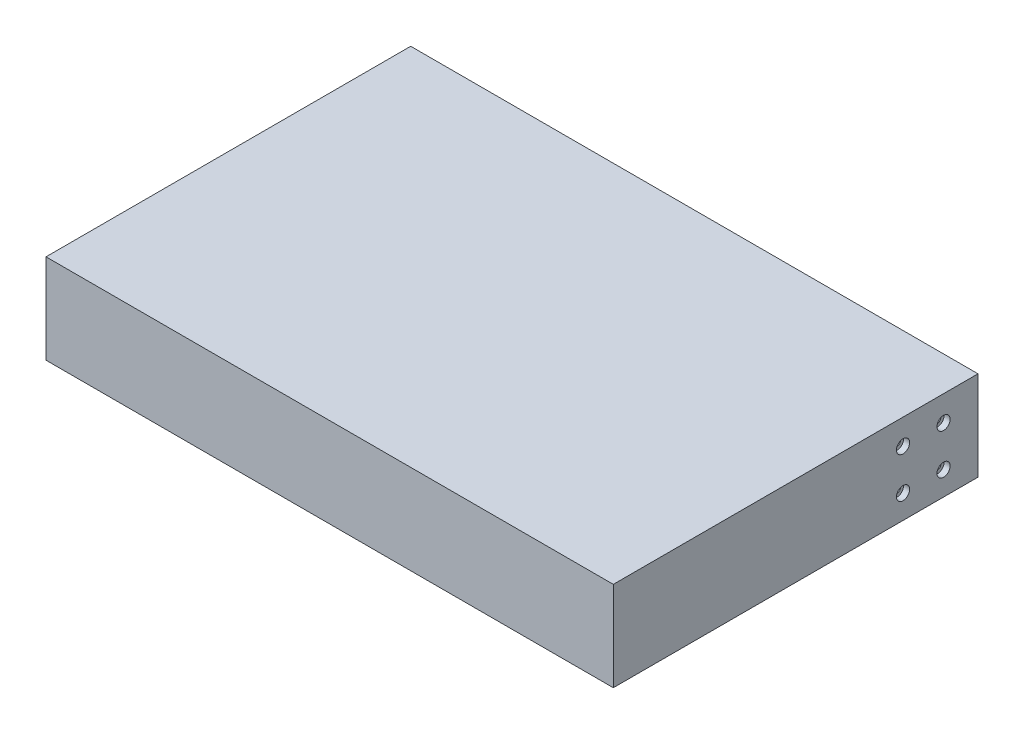
from build123d import *

# Parameters (mm, degrees)
SKETCH1_W                     = 280
SKETCH1_H                     = 44.2
BOSS_EXTRUDE1_DEPTH           = 180
SKETCH2_W                     = 4.274038461
SKETCH2_H                     = 1.139743589
CUT_EXTRUDE1_DEPTH            = 10
CBORE_FOR_M3_SHCS1_AT_2_COUNT = 2
CBORE_FOR_M3_SHCS1_AT_2_PITCH = 20
CBORE_FOR_M3_SHCS1_AT_3_COUNT = 2
CBORE_FOR_M3_SHCS1_AT_3_PITCH = 20
CBORE_FOR_M3_SHCS1_AT_4_COUNT = 2
CBORE_FOR_M3_SHCS1_AT_4_PITCH = 28.284271247


with BuildPart() as part:
    # Sketch1 → Boss-Extrude1 (new body)
    with BuildSketch(Plane.XY):
        Rectangle(SKETCH1_W, SKETCH1_H)
    extrude(amount=BOSS_EXTRUDE1_DEPTH)

    # Sketch2 → Cut-Extrude1 (cut)
    # profile 1 of 17: a face of its own
    with BuildSketch(Plane(origin=(0, 0, 0), x_dir=(-1, 0, 0), z_dir=(0, 0, -1))):
        Polygon((-78.844547364, 1.549676889), (-78.844547364, 2.689420479), (-73.003361466, 2.689420479), (-73.003361466, 1.549676889), (-75.425316595, 1.549676889), (-75.425316595, -8.423079521), (-76.422592236, -8.423079521), (-76.422592236, 1.549676889), align=None)
    # profile 2 of 17: a face of its own
    with BuildSketch(Plane(origin=(0, 0, 0), x_dir=(-1, 0, 0), z_dir=(0, 0, -1))):
        with BuildLine():
            Line((-71.293746082, 2.689420479), (-69.069910445, 2.689420479))
            add(Edge.make_bspline(
                [(-69.069910445, 2.689420479), (-68.921507362, 2.688926493), (-68.636557003, 2.687977987), (-68.22833687, 2.682689189), (-67.857410837, 2.66753061), (-67.523972847, 2.654485857), (-67.228029017, 2.630698944), (-66.968671869, 2.607963889), (-66.74709593, 2.578202516), (-66.612965352, 2.550562798), (-66.552234663, 2.538048283)],
                knots=[0, 0, 0, 0, 1.410062039, 2.707475311, 3.878576406, 4.937260626, 5.877586885, 6.699081471, 7.410979367, 8, 8, 8, 8], degree=3))
            add(Edge.make_bspline(
                [(-66.552234663, 2.538048283), (-66.470933632, 2.517960803), (-66.31006594, 2.478214364), (-66.078449481, 2.394205131), (-65.857741502, 2.296987823), (-65.64885881, 2.182803011), (-65.452847673, 2.050803086), (-65.267687036, 1.903266797), (-65.09253669, 1.741001418), (-64.934480014, 1.559915797), (-64.785448525, 1.369934878), (-64.659754636, 1.164500451), (-64.551403063, 0.949675101), (-64.465136671, 0.723274049), (-64.395674105, 0.487492924), (-64.346695795, 0.240195994), (-64.317323275, -0.017490102), (-64.314332883, -0.193251462), (-64.312816595, -0.282371889)],
                knots=[0, 0, 0, 0, 1.027469482, 2.033020251, 3.019912614, 3.986113645, 4.951240523, 5.91722682, 6.890402269, 7.87763091, 8.8651537, 9.85103654, 10.82876324, 11.815024772, 12.821070561, 13.842952187, 14.906261191, 16, 16, 16, 16], degree=3))
            add(Edge.make_bspline(
                [(-64.312816595, -0.282371889), (-64.317480664, -0.430438346), (-64.32658147, -0.719354354), (-64.411433674, -1.138647652), (-64.550424124, -1.529773726), (-64.741950567, -1.892240102), (-64.985852402, -2.218981401), (-65.278983614, -2.505971096), (-65.621507731, -2.746127819), (-65.940370809, -2.912665474), (-66.222038393, -3.019322959), (-66.453919161, -3.094368398), (-66.706861814, -3.152350138), (-66.978442852, -3.204293556), (-67.269792458, -3.243510186), (-67.580212333, -3.272233123), (-67.909923865, -3.290184728), (-68.13642541, -3.292858094), (-68.252945801, -3.294233367)],
                knots=[0, 0, 0, 0, 1.260483769, 2.459530307, 3.627416485, 4.787058657, 5.939039949, 7.08810263, 8.267026773, 9.491475466, 10.141966685, 10.831826277, 11.566392101, 12.351337768, 13.187381173, 14.07005841, 15.007169909, 16, 16, 16, 16], degree=3))
            Line((-68.252945801, -3.294233367), (-64.170348646, -8.423079521))
            Line((-64.170348646, -8.423079521), (-65.403586827, -8.423079521))
            Line((-65.403586827, -8.423079521), (-69.486183982, -3.294233367))
            Line((-69.486183982, -3.294233367), (-70.296470441, -3.294233367))
            Line((-70.296470441, -3.294233367), (-70.296470441, -8.423079521))
            Line((-70.296470441, -8.423079521), (-71.293746082, -8.423079521))
            Line((-71.293746082, -8.423079521), (-71.293746082, 2.689420479))
        make_face()
        with BuildLine():
            Line((-70.296470441, 1.549676889), (-70.296470441, -2.154489777))
            Line((-70.296470441, -2.154489777), (-68.261850048, -2.170072209))
            add(Edge.make_bspline(
                [(-68.261850048, -2.170072209), (-68.166853924, -2.170114236), (-67.982724381, -2.170195695), (-67.71633977, -2.157515455), (-67.468308415, -2.14309042), (-67.239579027, -2.121026248), (-67.030049425, -2.09259072), (-66.839824338, -2.057021245), (-66.668593249, -2.015580946), (-66.468890389, -1.951440784), (-66.245889402, -1.849821676), (-66.003537017, -1.701976218), (-65.797154595, -1.516019264), (-65.622790382, -1.303378542), (-65.482679437, -1.069583452), (-65.383898664, -0.817436479), (-65.32121641, -0.553303156), (-65.313823278, -0.371762663), (-65.310092236, -0.280145827)],
                knots=[0, 0, 0, 0, 1.146690395, 2.22261258, 3.21895312, 4.145990853, 4.996080663, 5.770904154, 6.481378293, 7.121626537, 8.300444488, 9.431385265, 10.535395872, 11.636531494, 12.74115979, 13.810798291, 14.895190096, 16, 16, 16, 16], degree=3))
            add(Edge.make_bspline(
                [(-65.310092236, -0.280145827), (-65.31390897, -0.190780456), (-65.321472345, -0.013690898), (-65.383222185, 0.245566617), (-65.487645971, 0.490254184), (-65.628369076, 0.719376424), (-65.799816393, 0.927357135), (-66.000850449, 1.105306846), (-66.225974443, 1.252148897), (-66.436385498, 1.345984055), (-66.624454123, 1.403514589), (-66.787743293, 1.443999534), (-66.972247235, 1.476525723), (-67.178861816, 1.502586316), (-67.406704994, 1.524985764), (-67.656928811, 1.540072661), (-67.927873088, 1.54900668), (-68.115664595, 1.549448287), (-68.212876691, 1.549676889)],
                knots=[0, 0, 0, 0, 1.101028733, 2.181837193, 3.264309656, 4.369019818, 5.486613113, 6.575447106, 7.666700264, 8.788928104, 9.402425223, 10.0903467, 10.862060571, 11.710948788, 12.657782767, 13.684531032, 14.801375019, 16, 16, 16, 16], degree=3))
            Line((-68.212876691, 1.549676889), (-70.296470441, 1.549676889))
        make_face(mode=Mode.SUBTRACT)
    # profile 3 of 17: a face of its own
    with BuildSketch(Plane(origin=(0, 0, 0), x_dir=(-1, 0, 0), z_dir=(0, 0, -1))):
        Polygon((-61.890861466, 2.689420479), (-55.622271723, 2.689420479), (-55.622271723, 1.549676889), (-60.893585825, 1.549676889), (-60.893585825, -1.86955388), (-55.622271723, -1.86955388), (-55.622271723, -3.00929747), (-60.893585825, -3.00929747), (-60.893585825, -7.283335931), (-55.622271723, -7.283335931), (-55.622271723, -8.423079521), (-61.890861466, -8.423079521), align=None)
    # profile 4 of 17: a face of its own
    with BuildSketch(Plane(origin=(0, 0, 0), x_dir=(-1, 0, 0), z_dir=(0, 0, -1))):
        Polygon((-53.627720441, -8.423079521), (-53.627720441, 2.689420479), (-53.418470641, 2.689420479), (-46.076919159, -6.056775935), (-46.076919159, 2.689420479), (-45.079643518, 2.689420479), (-45.079643518, -8.423079521), (-45.306701811, -8.423079521), (-52.6304448, 0.303082338), (-52.6304448, -8.423079521), align=None)
    # profile 5 of 17: a face of its own
    with BuildSketch(Plane(origin=(0, 0, 0), x_dir=(-1, 0, 0), z_dir=(0, 0, -1))):
        with BuildLine():
            Line((-42.230284543, -8.423079521), (-42.230284543, 2.689420479))
            Line((-42.230284543, 2.689420479), (-39.986414351, 2.689420479))
            add(Edge.make_bspline(
                [(-39.986414351, 2.689420479), (-39.791250313, 2.688015319), (-39.414194409, 2.685300558), (-38.869324888, 2.668087641), (-38.365186442, 2.637637912), (-37.903437114, 2.593284667), (-37.482809266, 2.538823785), (-37.104480686, 2.470560001), (-36.766495132, 2.38995256), (-36.558629658, 2.321228255), (-36.46033262, 2.288729373)],
                knots=[0, 0, 0, 0, 1.314313732, 2.53924729, 3.670748893, 4.714932338, 5.66265055, 6.526160246, 7.303039223, 8, 8, 8, 8], degree=3))
            add(Edge.make_bspline(
                [(-36.46033262, 2.288729373), (-36.331761823, 2.239736883), (-36.077535787, 2.142862889), (-35.715563173, 1.960121632), (-35.374805146, 1.753070034), (-35.053434361, 1.52143517), (-34.758791737, 1.258658364), (-34.479366665, 0.975902117), (-34.226589917, 0.662884137), (-33.995106077, 0.32609605), (-33.786395358, -0.030494716), (-33.604978532, -0.406208686), (-33.454312103, -0.799137822), (-33.329238609, -1.208189416), (-33.230666106, -1.634262916), (-33.163413473, -2.077854441), (-33.11905558, -2.537210867), (-33.114597717, -2.848914789), (-33.112335825, -3.007071408)],
                knots=[0, 0, 0, 0, 0.984719456, 1.947108742, 2.898477687, 3.838006223, 4.779231079, 5.722358779, 6.681677486, 7.655904652, 8.64651281, 9.637519902, 10.640069247, 11.656948941, 12.698408672, 13.768548281, 14.867775369, 16, 16, 16, 16], degree=3))
            add(Edge.make_bspline(
                [(-33.112335825, -3.007071408), (-33.114332797, -3.14442584), (-33.118268038, -3.415097095), (-33.153603616, -3.814006939), (-33.204963432, -4.201082528), (-33.284478761, -4.574480625), (-33.381006741, -4.937472717), (-33.504717921, -5.286190093), (-33.646435621, -5.623831688), (-33.811693986, -5.945832174), (-33.993117883, -6.250896881), (-34.187814418, -6.538474183), (-34.395575926, -6.804460512), (-34.61838356, -7.049661355), (-34.85335806, -7.273707066), (-35.10203781, -7.478469215), (-35.365064496, -7.659941277), (-35.641260041, -7.825254345), (-35.938681751, -7.969463974), (-36.262963126, -8.091479255), (-36.615487116, -8.192592259), (-36.995388429, -8.276954853), (-37.403323471, -8.343875289), (-37.839692188, -8.388726585), (-38.303824132, -8.419057146), (-38.622528299, -8.421712695), (-38.786567095, -8.423079521)],
                knots=[0, 0, 0, 0, 1.105936401, 2.179363191, 3.223086493, 4.248585256, 5.251745608, 6.245858792, 7.225916811, 8.198733463, 9.158002045, 10.082870192, 10.993790845, 11.873723703, 12.748670949, 13.606408763, 14.465103618, 15.319838547, 16.196477973, 17.123216899, 18.106603292, 19.147568657, 20.255746949, 21.433717677, 22.679120308, 24, 24, 24, 24], degree=3))
            Line((-38.786567095, -8.423079521), (-42.230284543, -8.423079521))
        make_face()
        with BuildLine():
            Line((-41.233008902, -7.283335931), (-39.957475549, -7.283335931))
            add(Edge.make_bspline(
                [(-39.957475549, -7.283335931), (-39.774187972, -7.282548225), (-39.421658837, -7.281033178), (-38.914744695, -7.267738808), (-38.451577612, -7.246015657), (-38.032091819, -7.215614785), (-37.656524167, -7.175391931), (-37.324089761, -7.130545365), (-37.035878316, -7.074673459), (-36.861477354, -7.024029163), (-36.780885505, -7.000626096)],
                knots=[0, 0, 0, 0, 1.375205317, 2.645023457, 3.804390687, 4.853969522, 5.800190428, 6.637939096, 7.370582563, 8, 8, 8, 8], degree=3))
            add(Edge.make_bspline(
                [(-36.780885505, -7.000626096), (-36.679449455, -6.964902398), (-36.479000154, -6.894308263), (-36.190452708, -6.765537689), (-35.921349219, -6.613004117), (-35.666999888, -6.443451897), (-35.431012757, -6.250900841), (-35.210591188, -6.039537952), (-35.006178969, -5.808287541), (-34.819888041, -5.557436628), (-34.653174176, -5.288546527), (-34.508803022, -5.00426073), (-34.382274409, -4.707694107), (-34.282964878, -4.394292529), (-34.205127898, -4.066857768), (-34.149995014, -3.725366791), (-34.115658264, -3.369883371), (-34.111653166, -3.128100377), (-34.109611466, -3.004845346)],
                knots=[0, 0, 0, 0, 0.998632004, 1.973411704, 2.929992603, 3.868527914, 4.809262121, 5.754881198, 6.702106254, 7.672490631, 8.653608572, 9.636854334, 10.631411391, 11.644891563, 12.686317036, 13.754757253, 14.855430412, 16, 16, 16, 16], degree=3))
            add(Edge.make_bspline(
                [(-34.109611466, -3.004845346), (-34.111241154, -2.874881546), (-34.114442689, -2.619566511), (-34.154683625, -2.244946054), (-34.213489563, -1.884644988), (-34.298527766, -1.538639218), (-34.406893307, -1.2062537), (-34.542131294, -0.889326755), (-34.696647811, -0.584511296), (-34.880490905, -0.298842685), (-35.081835414, -0.028672063), (-35.305285181, 0.218834794), (-35.547290153, 0.444241697), (-35.8052108, 0.651059015), (-36.08631609, 0.830966186), (-36.383984059, 0.991896398), (-36.702581565, 1.128471853), (-36.924236874, 1.201112242), (-37.0368826, 1.238028251)],
                knots=[0, 0, 0, 0, 1.122418816, 2.205001699, 3.251619955, 4.274784885, 5.280384055, 6.268708349, 7.249350384, 8.229342522, 9.199999885, 10.157847722, 11.105861043, 12.055065948, 13.010012805, 13.98527497, 14.976112212, 16, 16, 16, 16], degree=3))
            add(Edge.make_bspline(
                [(-37.0368826, 1.238028251), (-37.13007249, 1.26379791), (-37.328219764, 1.318591274), (-37.651560062, 1.378361832), (-38.015463162, 1.431081116), (-38.421544713, 1.475715391), (-38.86934182, 1.507742637), (-39.35919888, 1.53178156), (-39.891327624, 1.547995119), (-40.260207169, 1.549102264), (-40.451661246, 1.549676889)],
                knots=[0, 0, 0, 0, 0.674548936, 1.434276114, 2.292660221, 3.240891867, 4.284742987, 5.42552168, 6.663806718, 8, 8, 8, 8], degree=3))
            Line((-40.451661246, 1.549676889), (-41.233008902, 1.549676889))
            Line((-41.233008902, 1.549676889), (-41.233008902, -7.283335931))
        make_face(mode=Mode.SUBTRACT)
    # profile 6 of 17: a face of its own
    with BuildSketch(Plane(origin=(0, 0, 0), x_dir=(-1, 0, 0), z_dir=(0, 0, -1))):
        Polygon((-30.832848646, -8.423079521), (-30.832848646, 2.689420479), (-30.623598846, 2.689420479), (-23.282047364, -6.056775935), (-23.282047364, 2.689420479), (-22.284771723, 2.689420479), (-22.284771723, -8.423079521), (-22.511830016, -8.423079521), (-29.835573005, 0.303082338), (-29.835573005, -8.423079521), align=None)
    # profile 7 of 17: a face of its own
    with BuildSketch(Plane(origin=(0, 0, 0), x_dir=(-1, 0, 0), z_dir=(0, 0, -1))):
        Polygon((-19.435412748, 2.689420479), (-13.166823005, 2.689420479), (-13.166823005, 1.549676889), (-18.438137107, 1.549676889), (-18.438137107, -1.86955388), (-13.166823005, -1.86955388), (-13.166823005, -3.00929747), (-18.438137107, -3.00929747), (-18.438137107, -7.283335931), (-13.166823005, -7.283335931), (-13.166823005, -8.423079521), (-19.435412748, -8.423079521), align=None)
    # profile 8 of 17: a face of its own
    with BuildSketch(Plane(origin=(0, 0, 0), x_dir=(-1, 0, 0), z_dir=(0, 0, -1))):
        Polygon((-12.454483261, 1.549676889), (-12.454483261, 2.689420479), (-6.613297364, 2.689420479), (-6.613297364, 1.549676889), (-9.035252492, 1.549676889), (-9.035252492, -8.423079521), (-10.032528133, -8.423079521), (-10.032528133, 1.549676889), align=None)
    # profile 9 of 17: a face of its own
    with BuildSketch(Plane(origin=(0, 0, 0), x_dir=(-1, 0, 0), z_dir=(0, 0, -1))):
        Polygon((2.362183405, 1.549676889), (2.362183405, 2.689420479), (8.203369303, 2.689420479), (8.203369303, 1.549676889), (5.781414175, 1.549676889), (5.781414175, -8.423079521), (4.784138534, -8.423079521), (4.784138534, 1.549676889), align=None)
    # profile 10 of 17: a face of its own
    with BuildSketch(Plane(origin=(0, 0, 0), x_dir=(-1, 0, 0), z_dir=(0, 0, -1))):
        Polygon((9.912984688, 2.689420479), (16.181574431, 2.689420479), (16.181574431, 1.549676889), (10.910260329, 1.549676889), (10.910260329, -1.86955388), (16.181574431, -1.86955388), (16.181574431, -3.00929747), (10.910260329, -3.00929747), (10.910260329, -7.283335931), (16.181574431, -7.283335931), (16.181574431, -8.423079521), (9.912984688, -8.423079521), align=None)
    # profile 11 of 17: a face of its own
    with BuildSketch(Plane(origin=(0, 0, 0), x_dir=(-1, 0, 0), z_dir=(0, 0, -1))):
        with BuildLine():
            Line((28.57628597, 0.792815912), (27.721478277, -0.017470547))
            add(Edge.make_bspline(
                [(27.721478277, -0.017470547), (27.566795807, 0.128042443), (27.26111936, 0.415598583), (26.762770589, 0.788695993), (26.242821051, 1.108310861), (25.703983874, 1.368363161), (25.159602965, 1.575858176), (24.616904101, 1.723585021), (24.081453999, 1.817795328), (23.72532308, 1.8290614), (23.549838654, 1.834612787)],
                knots=[0, 0, 0, 0, 1.08915593, 2.152340314, 3.188132944, 4.216796309, 5.218260357, 6.173443236, 7.099959455, 8, 8, 8, 8], degree=3))
            add(Edge.make_bspline(
                [(23.549838654, 1.834612787), (23.442159482, 1.833299588), (23.227080408, 1.830676596), (22.907605735, 1.797198713), (22.591481663, 1.74905027), (22.279304948, 1.679384808), (21.970468614, 1.591091044), (21.666046781, 1.480647198), (21.36547158, 1.351884298), (21.071574272, 1.203095944), (20.786648174, 1.039647431), (20.51754522, 0.858518315), (20.262550179, 0.665513907), (20.026455829, 0.455802047), (19.807904111, 0.23128235), (19.60169303, -0.003868647), (19.415075115, -0.256075466), (19.246510667, -0.520697829), (19.096137528, -0.79308803), (18.963395053, -1.070624272), (18.851961799, -1.35238601), (18.763793778, -1.638726806), (18.691052452, -1.927431429), (18.639879049, -2.220498917), (18.611028706, -2.518243068), (18.606038305, -2.717624363), (18.603529559, -2.817856164)],
                knots=[0, 0, 0, 0, 1.02818874, 2.053710826, 3.065248034, 4.081641283, 5.106893873, 6.131558223, 7.173050175, 8.228653731, 9.27666206, 10.308777013, 11.325269123, 12.329503258, 13.32196095, 14.316845687, 15.314881793, 16.315733098, 17.311955233, 18.285320748, 19.252783886, 20.203351036, 21.145449891, 22.095197417, 23.042428769, 24, 24, 24, 24], degree=3))
            add(Edge.make_bspline(
                [(18.603529559, -2.817856164), (18.605928965, -2.920316008), (18.610721224, -3.124955914), (18.641392738, -3.430372094), (18.698314902, -3.731252247), (18.774412378, -4.02858507), (18.869601467, -4.322879782), (18.988259682, -4.612860501), (19.128802964, -4.898516493), (19.291479016, -5.177273926), (19.469870212, -5.448809525), (19.669714495, -5.704586007), (19.881996847, -5.948009375), (20.114450979, -6.173674925), (20.359623026, -6.387618796), (20.624838002, -6.583946578), (20.904880814, -6.766439937), (21.200178712, -6.932798886), (21.507527546, -7.081415986), (21.822667737, -7.213571857), (22.146606052, -7.322408753), (22.477640091, -7.411112233), (22.815375229, -7.483820676), (23.161525802, -7.530596302), (23.513546651, -7.56453969), (23.750841808, -7.567021492), (23.870391538, -7.568271829)],
                knots=[0, 0, 0, 0, 0.93586088, 1.869166235, 2.799637598, 3.729985548, 4.670839027, 5.622275134, 6.589130586, 7.576015415, 8.568469353, 9.55398029, 10.53834874, 11.515998671, 12.510579167, 13.508179873, 14.527009472, 15.561807829, 16.601455013, 17.643573243, 18.680854198, 19.719860599, 20.772568776, 21.833555941, 22.908541556, 24, 24, 24, 24], degree=3))
            add(Edge.make_bspline(
                [(23.870391538, -7.568271829), (24.014467791, -7.565260099), (24.29738492, -7.559346078), (24.713266876, -7.513307659), (25.112691625, -7.441404089), (25.494536821, -7.336102368), (25.859245961, -7.201788199), (26.20815605, -7.039877847), (26.538520066, -6.844161135), (26.851331142, -6.623264107), (27.139485206, -6.377154514), (27.39937205, -6.111583369), (27.626846479, -5.827839757), (27.825298899, -5.527594881), (27.989473876, -5.208363537), (28.124229751, -4.871710152), (28.227522952, -4.517483301), (28.269924997, -4.27271737), (28.291350072, -4.149041059)],
                knots=[0, 0, 0, 0, 1.13008108, 2.219097802, 3.278683437, 4.311054135, 5.322181354, 6.324827112, 7.324222904, 8.330512327, 9.32562643, 10.293043162, 11.24128371, 12.174520618, 13.111833804, 14.052305215, 15.015860969, 16, 16, 16, 16], degree=3))
            Line((28.291350072, -4.149041059), (24.587183405, -4.149041059))
            Line((24.587183405, -4.149041059), (24.587183405, -3.00929747))
            Line((24.587183405, -3.00929747), (29.288625713, -3.00929747))
            add(Edge.make_bspline(
                [(29.288625713, -3.00929747), (29.283209645, -3.221728747), (29.27260942, -3.637495129), (29.198254363, -4.243825739), (29.078186936, -4.816505866), (28.914165446, -5.356138618), (28.701836431, -5.861959275), (28.443478653, -6.3344814), (28.134957169, -6.770652362), (27.787261517, -7.174032948), (27.397054151, -7.533853197), (26.974878783, -7.85010205), (26.520037908, -8.116492854), (26.032961769, -8.333220457), (25.515244893, -8.502365391), (24.965689288, -8.622290147), (24.385040205, -8.69414028), (23.987096256, -8.70332041), (23.783575132, -8.708015418)],
                knots=[0, 0, 0, 0, 1.140356446, 2.231883559, 3.274166699, 4.278491846, 5.25512956, 6.21435461, 7.1637429, 8.11826594, 9.068280886, 10.0076534, 10.945064095, 11.891975133, 12.864533718, 13.863980011, 14.907571808, 16, 16, 16, 16], degree=3))
            add(Edge.make_bspline(
                [(23.783575132, -8.708015418), (23.658130452, -8.706208459), (23.410713114, -8.702644551), (23.045299417, -8.677316473), (22.689960972, -8.638325643), (22.344749544, -8.579444876), (22.008395307, -8.507325849), (21.682578125, -8.414975517), (21.366056844, -8.308077397), (21.05834224, -8.186488634), (20.762227304, -8.045608624), (20.476393112, -7.889050518), (20.199259663, -7.717621598), (19.932714714, -7.528357163), (19.675369466, -7.322672852), (19.428883283, -7.100156409), (19.19187627, -6.861488104), (19.043411798, -6.692009748), (18.968603678, -6.606613175)],
                knots=[0, 0, 0, 0, 1.107784379, 2.184907829, 3.233506516, 4.263428166, 5.276301166, 6.270063455, 7.25232949, 8.225834625, 9.190232166, 10.146266622, 11.1027726, 12.066435141, 13.031522626, 14.010570082, 14.99756817, 16, 16, 16, 16], degree=3))
            add(Edge.make_bspline(
                [(18.968603678, -6.606613175), (18.860063344, -6.471133852), (18.644784334, -6.202424022), (18.367676187, -5.771894199), (18.131451733, -5.326118292), (17.939783897, -4.863855347), (17.790120473, -4.385537747), (17.682785621, -3.891776697), (17.619897478, -3.38193637), (17.610837496, -3.036924155), (17.606253918, -2.862377398)],
                knots=[0, 0, 0, 0, 1.023165419, 2.029347347, 3.013907458, 3.994755782, 4.975994455, 5.96558838, 6.970761222, 8, 8, 8, 8], degree=3))
            add(Edge.make_bspline(
                [(17.606253918, -2.862377398), (17.607943774, -2.731674545), (17.61130201, -2.471929994), (17.652023023, -2.086303043), (17.710447525, -1.707523345), (17.796321924, -1.335900529), (17.904577564, -0.9711864), (18.039684882, -0.613211615), (18.196989927, -0.261764923), (18.379823877, 0.080734608), (18.583292036, 0.409742119), (18.804113986, 0.723933144), (19.045425416, 1.017585926), (19.30328558, 1.294419409), (19.580771024, 1.550955748), (19.875282194, 1.78957005), (20.187046058, 2.010582389), (20.517043429, 2.210511615), (20.860348827, 2.39010111), (21.216139332, 2.547546857), (21.584306334, 2.677668884), (21.962091575, 2.788075634), (22.35235464, 2.869721205), (22.75226347, 2.928930972), (23.163902575, 2.969445876), (23.442146968, 2.972704238), (23.583229579, 2.974356376)],
                knots=[0, 0, 0, 0, 1.008945113, 2.00506715, 2.99143336, 3.967273523, 4.948097931, 5.927297278, 6.919902385, 7.919676788, 8.923139349, 9.905703106, 10.883022732, 11.856032218, 12.825136022, 13.798837087, 14.781400844, 15.773989409, 16.776158564, 17.77167057, 18.775803737, 19.789618931, 20.80898985, 21.851988756, 22.910860228, 24, 24, 24, 24], degree=3))
            add(Edge.make_bspline(
                [(23.583229579, 2.974356376), (23.698286003, 2.97251649), (23.92642937, 2.968868212), (24.265918571, 2.943580454), (24.600160392, 2.903499632), (24.92965043, 2.848804584), (25.253266643, 2.774307367), (25.571930932, 2.685158813), (25.886105235, 2.581362276), (26.194804926, 2.457572689), (26.500105674, 2.31706743), (26.803705018, 2.158909814), (27.104565624, 1.980395424), (27.40320924, 1.780994199), (27.701519089, 1.564130847), (27.994776828, 1.323602932), (28.290061176, 1.068895682), (28.479931936, 0.885754749), (28.57628597, 0.792815912)],
                knots=[0, 0, 0, 0, 0.985871117, 1.954866573, 2.915460327, 3.869826059, 4.81536089, 5.759505086, 6.70452669, 7.649098992, 8.607881297, 9.583363685, 10.581137262, 11.603961102, 12.659522466, 13.73993555, 14.853081303, 16, 16, 16, 16], degree=3))
        make_face()
    # profile 12 of 17: a face of its own
    with BuildSketch(Plane(origin=(0, 0, 0), x_dir=(-1, 0, 0), z_dir=(0, 0, -1))):
        with Locations((32.707856482, -4.14904106)):
            Rectangle(SKETCH2_W, SKETCH2_H)
    # profile 13 of 17: a face of its own
    with BuildSketch(Plane(origin=(0, 0, 0), x_dir=(-1, 0, 0), z_dir=(0, 0, -1))):
        with BuildLine():
            Line((35.557215457, -6.279382105), (36.496613494, -5.716188495))
            add(Edge.make_bspline(
                [(36.496613494, -5.716188495), (36.583983897, -5.862442918), (36.751382218, -6.142660747), (37.030627783, -6.521305025), (37.319974776, -6.843129873), (37.62156591, -7.106263102), (37.933560295, -7.313428317), (38.257994666, -7.460120403), (38.593775715, -7.551611124), (38.822292598, -7.562723899), (38.936377115, -7.568271829)],
                knots=[0, 0, 0, 0, 1.272034388, 2.437168799, 3.508375237, 4.49857839, 5.41946034, 6.295179144, 7.148887113, 8, 8, 8, 8], degree=3))
            add(Edge.make_bspline(
                [(38.936377115, -7.568271829), (39.033807898, -7.565558244), (39.226964652, -7.560178554), (39.511324773, -7.508487008), (39.787491996, -7.429073499), (40.04977442, -7.315342041), (40.294552996, -7.177742349), (40.509204254, -7.011543235), (40.694770664, -6.825468532), (40.846564602, -6.617878604), (40.963023714, -6.394621657), (41.052533532, -6.165463011), (41.10220664, -5.926802807), (41.109689333, -5.766114588), (41.113465457, -5.685023632)],
                knots=[0, 0, 0, 0, 1.095163259, 2.171163733, 3.241058638, 4.321873601, 5.38011039, 6.391990106, 7.366004449, 8.327778327, 9.272591725, 10.192022065, 11.087607919, 12, 12, 12, 12], degree=3))
            add(Edge.make_bspline(
                [(41.113465457, -5.685023632), (41.10878452, -5.592501434), (41.09926886, -5.404417326), (41.018841411, -5.126923428), (40.892320053, -4.852309518), (40.775598659, -4.682443), (40.715000413, -4.594253399)],
                knots=[0, 0, 0, 0, 0.938893495, 1.908633276, 2.914225137, 4, 4, 4, 4], degree=3))
            add(Edge.make_bspline(
                [(40.715000413, -4.594253399), (40.665246213, -4.530604734), (40.560793493, -4.396982324), (40.381223391, -4.198083701), (40.170510978, -3.992920221), (39.935867191, -3.773657715), (39.668744634, -3.550493961), (39.377509776, -3.312787178), (39.054727024, -3.069577171), (38.828351122, -2.906469276), (38.711544884, -2.822308287)],
                knots=[0, 0, 0, 0, 0.722233717, 1.516239348, 2.393582979, 3.351407094, 4.387010283, 5.505090956, 6.712668013, 8, 8, 8, 8], degree=3))
            add(Edge.make_bspline(
                [(38.711544884, -2.822308287), (38.594628696, -2.739032521), (38.371093848, -2.579815599), (38.058487849, -2.343518497), (37.778946679, -2.127479211), (37.533712801, -1.929663973), (37.322894081, -1.750045953), (37.144829251, -1.590349996), (37.004054333, -1.44625719), (36.925772864, -1.35278093), (36.890626414, -1.310812394)],
                knots=[0, 0, 0, 0, 1.452282411, 2.77665338, 3.964542531, 5.026858415, 5.96415736, 6.766646006, 7.446254459, 8, 8, 8, 8], degree=3))
            add(Edge.make_bspline(
                [(36.890626414, -1.310812394), (36.841501083, -1.245404102), (36.744889527, -1.116769917), (36.617362459, -0.915713494), (36.508970617, -0.709899626), (36.424000213, -0.498775256), (36.352447718, -0.285304357), (36.304321288, -0.066701652), (36.274186103, 0.156051962), (36.271100046, 0.305954826), (36.2695552, 0.380994497)],
                knots=[0, 0, 0, 0, 1.068054152, 2.10047183, 3.106115577, 4.101338837, 5.06977816, 6.043150881, 7.020423561, 8, 8, 8, 8], degree=3))
            add(Edge.make_bspline(
                [(36.2695552, 0.380994497), (36.273699239, 0.498564032), (36.28189874, 0.731190134), (36.351242382, 1.071013021), (36.46069382, 1.395454895), (36.614030089, 1.701303705), (36.811697184, 1.980595694), (37.040443153, 2.236543515), (37.312894622, 2.451708764), (37.611829201, 2.639707049), (37.939033182, 2.786855362), (38.2819043, 2.897856474), (38.640987504, 2.960750867), (38.884202456, 2.969776646), (39.00761109, 2.974356376)],
                knots=[0, 0, 0, 0, 1.005424448, 1.989358655, 2.955360095, 3.929531133, 4.905563448, 5.876582895, 6.856512386, 7.866279853, 8.892233794, 9.918561126, 10.94386622, 12, 12, 12, 12], degree=3))
            add(Edge.make_bspline(
                [(39.00761109, 2.974356376), (39.138561108, 2.969839775), (39.3989789, 2.960857697), (39.782040159, 2.882760535), (40.150850434, 2.753535902), (40.4475328, 2.606886913), (40.679729317, 2.460419668), (40.856807744, 2.327006726), (41.03625065, 2.173415756), (41.219505474, 1.99923765), (41.403467068, 1.802874215), (41.590866529, 1.585670278), (41.782142082, 1.348953213), (41.905191938, 1.179965423), (41.968273149, 1.093334241)],
                knots=[0, 0, 0, 0, 1.286793592, 2.559021753, 3.825965368, 5.121522368, 5.803751409, 6.523245864, 7.299691795, 8.125521123, 9.008227632, 9.944561021, 10.946284179, 12, 12, 12, 12], degree=3))
            Line((41.968273149, 1.093334241), (41.066718161, 0.409933299))
            add(Edge.make_bspline(
                [(41.066718161, 0.409933299), (41.012279825, 0.480064892), (40.907444319, 0.615121941), (40.748283199, 0.804260868), (40.598268741, 0.97703319), (40.450471222, 1.127099972), (40.312696442, 1.262679245), (40.178974833, 1.378756473), (40.051230768, 1.476468988), (39.890204577, 1.580747291), (39.687900821, 1.68411419), (39.433949918, 1.771582513), (39.168563495, 1.824144835), (38.987811915, 1.831094553), (38.896308005, 1.834612787)],
                knots=[0, 0, 0, 0, 1.181633172, 2.275549214, 3.290209073, 4.226197932, 5.078386478, 5.862611352, 6.581680152, 7.217281963, 8.414376989, 9.595101626, 10.782541182, 12, 12, 12, 12], degree=3))
            add(Edge.make_bspline(
                [(38.896308005, 1.834612787), (38.781511046, 1.830765639), (38.560135926, 1.823346778), (38.245841926, 1.742320825), (37.962968714, 1.614743418), (37.71991432, 1.435943363), (37.517549418, 1.224104211), (37.371164586, 0.980331346), (37.283057814, 0.711147218), (37.272306376, 0.523372459), (37.266830841, 0.427741793)],
                knots=[0, 0, 0, 0, 1.14458467, 2.207223713, 3.21896685, 4.227309161, 5.202851033, 6.127160689, 7.046193047, 8, 8, 8, 8], degree=3))
            add(Edge.make_bspline(
                [(37.266830841, 0.427741793), (37.268079018, 0.368205849), (37.270577414, 0.249036607), (37.305422396, 0.072978342), (37.350187766, -0.10263516), (37.421125621, -0.277014361), (37.51905946, -0.453208951), (37.647663394, -0.634252968), (37.80963066, -0.821742143), (37.933700174, -0.943685554), (37.99920514, -1.008068003)],
                knots=[0, 0, 0, 0, 0.858281714, 1.717966888, 2.583508476, 3.4729293, 4.427298488, 5.488583878, 6.674047936, 8, 8, 8, 8], degree=3))
            add(Edge.make_bspline(
                [(37.99920514, -1.008068003), (38.023529998, -1.02977556), (38.081320291, -1.081347746), (38.186971355, -1.165778237), (38.326489739, -1.269927039), (38.496232228, -1.398791769), (38.699328602, -1.548275411), (38.935801192, -1.71646663), (39.203014059, -1.908825462), (39.392631142, -2.043310654), (39.49289254, -2.114420667)],
                knots=[0, 0, 0, 0, 0.420754252, 0.999615792, 1.744751191, 2.668019286, 3.750313428, 4.999500688, 6.413464383, 8, 8, 8, 8], degree=3))
            add(Edge.make_bspline(
                [(39.49289254, -2.114420667), (39.613497815, -2.202181983), (39.847033214, -2.37211961), (40.17932103, -2.627439394), (40.480608871, -2.877146059), (40.751954542, -3.119644961), (40.996038726, -3.353096657), (41.21015349, -3.580309754), (41.396480525, -3.799656447), (41.597074543, -4.080874375), (41.80204562, -4.426254318), (41.978072406, -4.849412725), (42.089065159, -5.274216043), (42.103579721, -5.559733749), (42.110741098, -5.700606064)],
                knots=[0, 0, 0, 0, 1.163667725, 2.253281268, 3.268753668, 4.215851969, 5.092017293, 5.902905408, 6.650798638, 7.335211899, 8.59617414, 9.77448103, 10.901945474, 12, 12, 12, 12], degree=3))
            add(Edge.make_bspline(
                [(42.110741098, -5.700606064), (42.108654684, -5.800232373), (42.104522374, -5.997550315), (42.057021473, -6.287285185), (41.987426536, -6.568688196), (41.882533318, -6.838280978), (41.75450729, -7.100995599), (41.592054454, -7.349940683), (41.403752554, -7.590625999), (41.187745351, -7.816633584), (40.951379611, -8.024107756), (40.70155888, -8.208667526), (40.437874264, -8.362554453), (40.161756208, -8.488128376), (39.873141289, -8.586342295), (39.572126576, -8.657503154), (39.258215878, -8.701177536), (39.044854349, -8.705710679), (38.936377115, -8.708015418)],
                knots=[0, 0, 0, 0, 0.983748083, 1.948392443, 2.894712957, 3.844097841, 4.80183111, 5.778335162, 6.776009319, 7.81870978, 8.863265674, 9.881300176, 10.883814829, 11.87499822, 12.874611388, 13.892143829, 14.928324115, 16, 16, 16, 16], degree=3))
            add(Edge.make_bspline(
                [(38.936377115, -8.708015418), (38.852444901, -8.706392417), (38.685637513, -8.703166854), (38.438909908, -8.674651288), (38.197166713, -8.634306235), (37.963441367, -8.570253562), (37.734722585, -8.49253916), (37.512005116, -8.396849954), (37.29518102, -8.28217784), (37.083035194, -8.151066136), (36.87610719, -7.998482797), (36.676337879, -7.820766946), (36.477172715, -7.622819968), (36.284490232, -7.399266429), (36.094392999, -7.153718016), (35.910629048, -6.883877359), (35.729394595, -6.591214261), (35.615680484, -6.385267614), (35.557215457, -6.279382105)],
                knots=[0, 0, 0, 0, 0.915332311, 1.819136955, 2.706846663, 3.586547465, 4.459518054, 5.340707479, 6.227863349, 7.133153174, 8.059268498, 9.028702269, 10.047606654, 11.120612155, 12.245963614, 13.433783089, 14.680604001, 16, 16, 16, 16], degree=3))
        make_face()
    # profile 14 of 17: a face of its own
    with BuildSketch(Plane(origin=(0, 0, 0), x_dir=(-1, 0, 0), z_dir=(0, 0, -1))):
        with BuildLine():
            Line((44.817632123, -0.72981029), (43.820356482, -0.72981029))
            add(Edge.make_bspline(
                [(43.820356482, -0.72981029), (43.826856193, -0.597505222), (43.839621452, -0.337661588), (43.899401271, 0.041191815), (43.984938556, 0.403315801), (44.105878922, 0.745802778), (44.256076354, 1.071680991), (44.436194191, 1.379656041), (44.649534666, 1.668553065), (44.891491047, 1.935693892), (45.154281476, 2.180764429), (45.437827834, 2.392394825), (45.735785796, 2.571203432), (46.047251387, 2.720686375), (46.375738677, 2.832890386), (46.71826675, 2.916144091), (47.076340508, 2.966233989), (47.320307578, 2.971618108), (47.444384928, 2.974356376)],
                knots=[0, 0, 0, 0, 1.10065271, 2.161652631, 3.183658789, 4.190468796, 5.17591951, 6.163126047, 7.15150782, 8.156236427, 9.156009102, 10.134482811, 11.092018607, 12.041330605, 13.001268258, 13.972401359, 14.968799086, 16, 16, 16, 16], degree=3))
            add(Edge.make_bspline(
                [(47.444384928, 2.974356376), (47.566235313, 2.971503777), (47.805666967, 2.965898522), (48.155113863, 2.917762254), (48.487781773, 2.84237), (48.803020432, 2.736593553), (49.098314687, 2.594402996), (49.375882853, 2.423595811), (49.639029428, 2.226047847), (49.875905966, 1.993466989), (50.093419117, 1.745174418), (50.281068777, 1.480100324), (50.441765571, 1.206322342), (50.575711455, 0.921752802), (50.674314696, 0.623712287), (50.749175507, 0.316539918), (50.791490045, -0.002943857), (50.797984265, -0.219182171), (50.80128597, -0.329119184)],
                knots=[0, 0, 0, 0, 1.111607364, 2.184268762, 3.212621178, 4.221274766, 5.211760367, 6.196651075, 7.1921475, 8.207485113, 9.220403448, 10.201281604, 11.166441695, 12.114753415, 13.065576456, 14.026450734, 14.996634279, 16, 16, 16, 16], degree=3))
            add(Edge.make_bspline(
                [(50.80128597, -0.329119184), (50.795930872, -0.483899829), (50.785314651, -0.790744936), (50.693697795, -1.242243771), (50.552149637, -1.680092334), (50.380467769, -2.032450825), (50.207047467, -2.314952461), (50.054076616, -2.549634622), (49.871030396, -2.799908494), (49.659583609, -3.068294765), (49.422926074, -3.355614389), (49.159354504, -3.661985272), (48.866855436, -3.984153491), (48.661565709, -4.204199447), (48.555189716, -4.318221749)],
                knots=[0, 0, 0, 0, 1.184203166, 2.347625244, 3.513805382, 4.700623107, 5.337941753, 6.051866363, 6.845199593, 7.711357327, 8.668078039, 9.695487809, 10.805859518, 12, 12, 12, 12], degree=3))
            Line((48.555189716, -4.318221749), (45.774838654, -7.283335931))
            Line((45.774838654, -7.283335931), (50.943753918, -7.283335931))
            Line((50.943753918, -7.283335931), (50.943753918, -8.423079521))
            Line((50.943753918, -8.423079521), (43.392952636, -8.423079521))
            Line((43.392952636, -8.423079521), (47.702608085, -3.824036051))
            add(Edge.make_bspline(
                [(47.702608085, -3.824036051), (47.807535126, -3.714503928), (48.009078497, -3.504115136), (48.294138178, -3.196956237), (48.550166966, -2.912001445), (48.778822188, -2.649789154), (48.975143568, -2.406483926), (49.149362904, -2.189965742), (49.288953655, -1.990720363), (49.440450037, -1.759768914), (49.587179428, -1.477789807), (49.713266158, -1.133195343), (49.790148302, -0.778461316), (49.799371155, -0.538742348), (49.804010329, -0.418161652)],
                knots=[0, 0, 0, 0, 1.329631726, 2.553950428, 3.673215718, 4.687767853, 5.603093632, 6.413772471, 7.123043292, 7.734684054, 8.834405432, 9.900288307, 10.943827018, 12, 12, 12, 12], degree=3))
            add(Edge.make_bspline(
                [(49.804010329, -0.418161652), (49.801991847, -0.342338212), (49.798013807, -0.192904773), (49.762905617, 0.026188512), (49.70984976, 0.237531796), (49.633823566, 0.441775162), (49.533472166, 0.636865107), (49.411319185, 0.823039107), (49.270380734, 1.003026571), (49.107340454, 1.171788293), (48.928233878, 1.32635112), (48.739022136, 1.463270091), (48.538838055, 1.577694268), (48.328525667, 1.671494872), (48.108671301, 1.745076707), (47.878849736, 1.796062697), (47.639695984, 1.828074583), (47.476394635, 1.832405829), (47.393185509, 1.834612787)],
                knots=[0, 0, 0, 0, 0.991446411, 1.95395049, 2.89581595, 3.838931463, 4.798493298, 5.75982156, 6.748411868, 7.785213223, 8.824556874, 9.840280684, 10.836137867, 11.835679398, 12.848801643, 13.863922112, 14.911575587, 16, 16, 16, 16], degree=3))
            add(Edge.make_bspline(
                [(47.393185509, 1.834612787), (47.306283115, 1.832342559), (47.135621162, 1.827884207), (46.885053232, 1.796697249), (46.646020889, 1.742894206), (46.417922847, 1.669308265), (46.200373162, 1.575777372), (45.994429822, 1.459281083), (45.800555149, 1.320268492), (45.618384687, 1.162659726), (45.450541553, 0.987185092), (45.303072723, 0.791573459), (45.174218478, 0.579396415), (45.061794161, 0.351226467), (44.970494845, 0.104993216), (44.900730093, -0.158429247), (44.845526854, -0.437897133), (44.827084801, -0.630889777), (44.817632123, -0.72981029)],
                knots=[0, 0, 0, 0, 1.031018746, 2.02475058, 2.990194455, 3.934040569, 4.864654155, 5.795059489, 6.735614925, 7.690564532, 8.649604399, 9.611025574, 10.590972636, 11.591080095, 12.624614302, 13.701020113, 14.821632451, 16, 16, 16, 16], degree=3))
        make_face()
    # profile 15 of 17: a face of its own
    with BuildSketch(Plane(origin=(0, 0, 0), x_dir=(-1, 0, 0), z_dir=(0, 0, -1))):
        Polygon((58.007047688, 2.974356376), (58.209619303, 2.974356376), (58.209619303, -4.718912854), (59.491830841, -4.718912854), (59.491830841, -5.858656444), (58.209619303, -5.858656444), (58.209619303, -8.423079521), (57.212343662, -8.423079521), (57.212343662, -5.858656444), (51.941029559, -5.858656444), align=None)
        Polygon((57.212343662, -4.718912854), (57.212343662, 0.102736785), (53.902189916, -4.718912854), align=None, mode=Mode.SUBTRACT)
    # profile 16 of 17: a face of its own
    with BuildSketch(Plane(origin=(0, 0, 0), x_dir=(-1, 0, 0), z_dir=(0, 0, -1))):
        with BuildLine():
            Line((61.486382123, -8.423079521), (61.486382123, 2.689420479))
            Line((61.486382123, 2.689420479), (63.730252316, 2.689420479))
            add(Edge.make_bspline(
                [(63.730252316, 2.689420479), (63.925416353, 2.688015319), (64.302472258, 2.685300558), (64.847341779, 2.668087641), (65.351480225, 2.637637912), (65.813229552, 2.593284667), (66.2338574, 2.538823785), (66.612185981, 2.470560001), (66.950171535, 2.38995256), (67.158037009, 2.321228255), (67.256334047, 2.288729373)],
                knots=[0, 0, 0, 0, 1.314313732, 2.53924729, 3.670748893, 4.714932338, 5.66265055, 6.526160246, 7.303039223, 8, 8, 8, 8], degree=3))
            add(Edge.make_bspline(
                [(67.256334047, 2.288729373), (67.384904844, 2.239736883), (67.639130879, 2.142862889), (68.001103493, 1.960121632), (68.341861521, 1.753070034), (68.663232306, 1.52143517), (68.95787493, 1.258658364), (69.237300002, 0.975902117), (69.49007675, 0.662884137), (69.72156059, 0.32609605), (69.930271309, -0.030494716), (70.111688135, -0.406208686), (70.262354564, -0.799137822), (70.387428058, -1.208189416), (70.486000561, -1.634262916), (70.553253194, -2.077854441), (70.597611087, -2.537210867), (70.60206895, -2.848914789), (70.604330841, -3.007071408)],
                knots=[0, 0, 0, 0, 0.984719456, 1.947108742, 2.898477687, 3.838006223, 4.779231079, 5.722358779, 6.681677486, 7.655904652, 8.64651281, 9.637519902, 10.640069247, 11.656948941, 12.698408672, 13.768548281, 14.867775369, 16, 16, 16, 16], degree=3))
            add(Edge.make_bspline(
                [(70.604330841, -3.007071408), (70.60233387, -3.14442584), (70.598398628, -3.415097095), (70.56306305, -3.814006939), (70.511703234, -4.201082528), (70.432187906, -4.574480625), (70.335659926, -4.937472717), (70.211948746, -5.286190093), (70.070231045, -5.623831688), (69.904972681, -5.945832174), (69.723548783, -6.250896881), (69.528852249, -6.538474183), (69.321090741, -6.804460512), (69.098283106, -7.049661355), (68.863308607, -7.273707066), (68.614628857, -7.478469215), (68.351602171, -7.659941277), (68.075406626, -7.825254345), (67.777984916, -7.969463974), (67.453703541, -8.091479255), (67.101179551, -8.192592259), (66.721278237, -8.276954853), (66.313343196, -8.343875289), (65.876974479, -8.388726585), (65.412842534, -8.419057146), (65.094138367, -8.421712695), (64.930099571, -8.423079521)],
                knots=[0, 0, 0, 0, 1.105936401, 2.179363191, 3.223086493, 4.248585256, 5.251745608, 6.245858792, 7.225916811, 8.198733463, 9.158002045, 10.082870192, 10.993790845, 11.873723703, 12.748670949, 13.606408763, 14.465103618, 15.319838547, 16.196477973, 17.123216899, 18.106603292, 19.147568657, 20.255746949, 21.433717677, 22.679120308, 24, 24, 24, 24], degree=3))
            Line((64.930099571, -8.423079521), (61.486382123, -8.423079521))
        make_face()
        with BuildLine():
            Line((62.483657764, -7.283335931), (63.759191118, -7.283335931))
            add(Edge.make_bspline(
                [(63.759191118, -7.283335931), (63.942478695, -7.282548225), (64.29500783, -7.281033178), (64.801921971, -7.267738808), (65.265089055, -7.246015657), (65.684574847, -7.215614785), (66.0601425, -7.175391931), (66.392576905, -7.130545365), (66.680788351, -7.074673459), (66.855189313, -7.024029163), (66.935781162, -7.000626096)],
                knots=[0, 0, 0, 0, 1.375205317, 2.645023457, 3.804390687, 4.853969522, 5.800190428, 6.637939096, 7.370582563, 8, 8, 8, 8], degree=3))
            add(Edge.make_bspline(
                [(66.935781162, -7.000626096), (67.037217211, -6.964902398), (67.237666513, -6.894308263), (67.526213958, -6.765537689), (67.795317448, -6.613004117), (68.049666778, -6.443451897), (68.285653909, -6.250900841), (68.506075479, -6.039537952), (68.710487698, -5.808287541), (68.896778626, -5.557436628), (69.063492491, -5.288546527), (69.207863644, -5.00426073), (69.334392257, -4.707694107), (69.433701789, -4.394292529), (69.511538769, -4.066857768), (69.566671653, -3.725366791), (69.601008403, -3.369883371), (69.6050135, -3.128100377), (69.6070552, -3.004845346)],
                knots=[0, 0, 0, 0, 0.998632004, 1.973411704, 2.929992603, 3.868527914, 4.809262121, 5.754881198, 6.702106254, 7.672490631, 8.653608572, 9.636854334, 10.631411391, 11.644891563, 12.686317036, 13.754757253, 14.855430412, 16, 16, 16, 16], degree=3))
            add(Edge.make_bspline(
                [(69.6070552, -3.004845346), (69.605425513, -2.874881546), (69.602223978, -2.619566511), (69.561983042, -2.244946054), (69.503177103, -1.884644988), (69.4181389, -1.538639218), (69.30977336, -1.2062537), (69.174535372, -0.889326755), (69.020018856, -0.584511296), (68.836175762, -0.298842685), (68.634831253, -0.028672063), (68.411381486, 0.218834794), (68.169376514, 0.444241697), (67.911455866, 0.651059015), (67.630350576, 0.830966186), (67.332682608, 0.991896398), (67.014085102, 1.128471853), (66.792429793, 1.201112242), (66.679784067, 1.238028251)],
                knots=[0, 0, 0, 0, 1.122418816, 2.205001699, 3.251619955, 4.274784885, 5.280384055, 6.268708349, 7.249350384, 8.229342522, 9.199999885, 10.157847722, 11.105861043, 12.055065948, 13.010012805, 13.98527497, 14.976112212, 16, 16, 16, 16], degree=3))
            add(Edge.make_bspline(
                [(66.679784067, 1.238028251), (66.586594177, 1.26379791), (66.388446903, 1.318591274), (66.065106604, 1.378361832), (65.701203505, 1.431081116), (65.295121954, 1.475715391), (64.847324846, 1.507742637), (64.357467787, 1.53178156), (63.825339042, 1.547995119), (63.456459497, 1.549102264), (63.265005421, 1.549676889)],
                knots=[0, 0, 0, 0, 0.674548936, 1.434276114, 2.292660221, 3.240891867, 4.284742987, 5.42552168, 6.663806718, 8, 8, 8, 8], degree=3))
            Line((63.265005421, 1.549676889), (62.483657764, 1.549676889))
            Line((62.483657764, 1.549676889), (62.483657764, -7.283335931))
        make_face(mode=Mode.SUBTRACT)
    # profile 17 of 17: a face of its own
    with BuildSketch(Plane(origin=(0, 0, 0), x_dir=(-1, 0, 0), z_dir=(0, 0, -1))):
        with BuildLine():
            Line((83.283978277, 0.792815912), (82.429170585, -0.017470547))
            add(Edge.make_bspline(
                [(82.429170585, -0.017470547), (82.274488115, 0.128042443), (81.968811667, 0.415598583), (81.470462897, 0.788695993), (80.950513359, 1.108310861), (80.411676182, 1.368363161), (79.867295273, 1.575858176), (79.324596408, 1.723585021), (78.789146306, 1.817795328), (78.433015388, 1.8290614), (78.257530962, 1.834612787)],
                knots=[0, 0, 0, 0, 1.08915593, 2.152340314, 3.188132944, 4.216796309, 5.218260357, 6.173443236, 7.099959455, 8, 8, 8, 8], degree=3))
            add(Edge.make_bspline(
                [(78.257530962, 1.834612787), (78.149851789, 1.833299588), (77.934772715, 1.830676596), (77.615298043, 1.797198713), (77.29917397, 1.74905027), (76.986997256, 1.679384808), (76.678160921, 1.591091044), (76.373739089, 1.480647198), (76.073163887, 1.351884298), (75.77926658, 1.203095944), (75.494340481, 1.039647431), (75.225237528, 0.858518315), (74.970242487, 0.665513907), (74.734148136, 0.455802047), (74.515596418, 0.23128235), (74.309385338, -0.003868647), (74.122767423, -0.256075466), (73.954202974, -0.520697829), (73.803829836, -0.79308803), (73.671087361, -1.070624272), (73.559654106, -1.35238601), (73.471486086, -1.638726806), (73.39874476, -1.927431429), (73.347571357, -2.220498917), (73.318721014, -2.518243068), (73.313730612, -2.717624363), (73.311221867, -2.817856164)],
                knots=[0, 0, 0, 0, 1.02818874, 2.053710826, 3.065248034, 4.081641283, 5.106893873, 6.131558223, 7.173050175, 8.228653731, 9.27666206, 10.308777013, 11.325269123, 12.329503258, 13.32196095, 14.316845687, 15.314881793, 16.315733098, 17.311955233, 18.285320748, 19.252783886, 20.203351036, 21.145449891, 22.095197417, 23.042428769, 24, 24, 24, 24], degree=3))
            add(Edge.make_bspline(
                [(73.311221867, -2.817856164), (73.313621273, -2.920316008), (73.318413532, -3.124955914), (73.349085046, -3.430372094), (73.40600721, -3.731252247), (73.482104685, -4.02858507), (73.577293775, -4.322879782), (73.69595199, -4.612860501), (73.836495271, -4.898516493), (73.999171324, -5.177273926), (74.17756252, -5.448809525), (74.377406802, -5.704586007), (74.589689155, -5.948009375), (74.822143287, -6.173674925), (75.067315333, -6.387618796), (75.33253031, -6.583946578), (75.612573122, -6.766439937), (75.907871019, -6.932798886), (76.215219854, -7.081415986), (76.530360045, -7.213571857), (76.854298359, -7.322408753), (77.185332399, -7.411112233), (77.523067536, -7.483820676), (77.86921811, -7.530596302), (78.221238959, -7.56453969), (78.458534116, -7.567021492), (78.578083846, -7.568271829)],
                knots=[0, 0, 0, 0, 0.93586088, 1.869166235, 2.799637598, 3.729985548, 4.670839027, 5.622275134, 6.589130586, 7.576015415, 8.568469353, 9.55398029, 10.53834874, 11.515998671, 12.510579167, 13.508179873, 14.527009472, 15.561807829, 16.601455013, 17.643573243, 18.680854198, 19.719860599, 20.772568776, 21.833555941, 22.908541556, 24, 24, 24, 24], degree=3))
            add(Edge.make_bspline(
                [(78.578083846, -7.568271829), (78.722160099, -7.565260099), (79.005077228, -7.559346078), (79.420959184, -7.513307659), (79.820383933, -7.441404089), (80.202229128, -7.336102368), (80.566938269, -7.201788199), (80.915848358, -7.039877847), (81.246212374, -6.844161135), (81.55902345, -6.623264107), (81.847177514, -6.377154514), (82.107064358, -6.111583369), (82.334538786, -5.827839757), (82.532991206, -5.527594881), (82.697166184, -5.208363537), (82.831922058, -4.871710152), (82.935215259, -4.517483301), (82.977617304, -4.27271737), (82.99904238, -4.149041059)],
                knots=[0, 0, 0, 0, 1.13008108, 2.219097802, 3.278683437, 4.311054135, 5.322181354, 6.324827112, 7.324222904, 8.330512327, 9.32562643, 10.293043162, 11.24128371, 12.174520618, 13.111833804, 14.052305215, 15.015860969, 16, 16, 16, 16], degree=3))
            Line((82.99904238, -4.149041059), (79.294875713, -4.149041059))
            Line((79.294875713, -4.149041059), (79.294875713, -3.00929747))
            Line((79.294875713, -3.00929747), (83.996318021, -3.00929747))
            add(Edge.make_bspline(
                [(83.996318021, -3.00929747), (83.990901952, -3.221728747), (83.980301728, -3.637495129), (83.90594667, -4.243825739), (83.785879244, -4.816505866), (83.621857754, -5.356138618), (83.409528739, -5.861959275), (83.151170961, -6.3344814), (82.842649477, -6.770652362), (82.494953825, -7.174032948), (82.104746459, -7.533853197), (81.68257109, -7.85010205), (81.227730216, -8.116492854), (80.740654077, -8.333220457), (80.222937201, -8.502365391), (79.673381595, -8.622290147), (79.092732513, -8.69414028), (78.694788564, -8.70332041), (78.49126744, -8.708015418)],
                knots=[0, 0, 0, 0, 1.140356446, 2.231883559, 3.274166699, 4.278491846, 5.25512956, 6.21435461, 7.1637429, 8.11826594, 9.068280886, 10.0076534, 10.945064095, 11.891975133, 12.864533718, 13.863980011, 14.907571808, 16, 16, 16, 16], degree=3))
            add(Edge.make_bspline(
                [(78.49126744, -8.708015418), (78.36582276, -8.706208459), (78.118405421, -8.702644551), (77.752991725, -8.677316473), (77.397653279, -8.638325643), (77.052441851, -8.579444876), (76.716087615, -8.507325849), (76.390270433, -8.414975517), (76.073749152, -8.308077397), (75.766034547, -8.186488634), (75.469919611, -8.045608624), (75.18408542, -7.889050518), (74.906951971, -7.717621598), (74.640407022, -7.528357163), (74.383061774, -7.322672852), (74.13657559, -7.100156409), (73.899568577, -6.861488104), (73.751104106, -6.692009748), (73.676295986, -6.606613175)],
                knots=[0, 0, 0, 0, 1.107784379, 2.184907829, 3.233506516, 4.263428166, 5.276301166, 6.270063455, 7.25232949, 8.225834625, 9.190232166, 10.146266622, 11.1027726, 12.066435141, 13.031522626, 14.010570082, 14.99756817, 16, 16, 16, 16], degree=3))
            add(Edge.make_bspline(
                [(73.676295986, -6.606613175), (73.567755652, -6.471133852), (73.352476642, -6.202424022), (73.075368494, -5.771894199), (72.83914404, -5.326118292), (72.647476205, -4.863855347), (72.497812781, -4.385537747), (72.390477928, -3.891776697), (72.327589785, -3.38193637), (72.318529804, -3.036924155), (72.313946226, -2.862377398)],
                knots=[0, 0, 0, 0, 1.023165419, 2.029347347, 3.013907458, 3.994755782, 4.975994455, 5.96558838, 6.970761222, 8, 8, 8, 8], degree=3))
            add(Edge.make_bspline(
                [(72.313946226, -2.862377398), (72.315636082, -2.731674545), (72.318994317, -2.471929994), (72.359715331, -2.086303043), (72.418139833, -1.707523345), (72.504014231, -1.335900529), (72.612269872, -0.9711864), (72.74737719, -0.613211615), (72.904682235, -0.261764923), (73.087516185, 0.080734608), (73.290984344, 0.409742119), (73.511806293, 0.723933144), (73.753117724, 1.017585926), (74.010977888, 1.294419409), (74.288463332, 1.550955748), (74.582974502, 1.78957005), (74.894738365, 2.010582389), (75.224735737, 2.210511615), (75.568041135, 2.39010111), (75.92383164, 2.547546857), (76.291998642, 2.677668884), (76.669783883, 2.788075634), (77.060046948, 2.869721205), (77.459955777, 2.928930972), (77.871594883, 2.969445876), (78.149839276, 2.972704238), (78.290921887, 2.974356376)],
                knots=[0, 0, 0, 0, 1.008945113, 2.00506715, 2.99143336, 3.967273523, 4.948097931, 5.927297278, 6.919902385, 7.919676788, 8.923139349, 9.905703106, 10.883022732, 11.856032218, 12.825136022, 13.798837087, 14.781400844, 15.773989409, 16.776158564, 17.77167057, 18.775803737, 19.789618931, 20.80898985, 21.851988756, 22.910860228, 24, 24, 24, 24], degree=3))
            add(Edge.make_bspline(
                [(78.290921887, 2.974356376), (78.405978311, 2.97251649), (78.634121678, 2.968868212), (78.973610878, 2.943580454), (79.3078527, 2.903499632), (79.637342738, 2.848804584), (79.96095895, 2.774307367), (80.27962324, 2.685158813), (80.593797543, 2.581362276), (80.902497234, 2.457572689), (81.207797982, 2.31706743), (81.511397326, 2.158909814), (81.812257932, 1.980395424), (82.110901548, 1.780994199), (82.409211397, 1.564130847), (82.702469136, 1.323602932), (82.997753484, 1.068895682), (83.187624244, 0.885754749), (83.283978277, 0.792815912)],
                knots=[0, 0, 0, 0, 0.985871117, 1.954866573, 2.915460327, 3.869826059, 4.81536089, 5.759505086, 6.70452669, 7.649098992, 8.607881297, 9.583363685, 10.581137262, 11.603961102, 12.659522466, 13.73993555, 14.853081303, 16, 16, 16, 16], degree=3))
        make_face()
    extrude(amount=-CUT_EXTRUDE1_DEPTH, mode=Mode.SUBTRACT)

    # Sketch4 → CBORE for M3 SHCS1 (revolve, cut)
    with BuildSketch(Plane(origin=(-140, 9.6, 17), x_dir=(0, 0, 1), z_dir=(0, 1, 0))):
        Polygon((0, 0), (0, 11.121463052), (1.7, 10.1), (1.7, 3), (3.25, 3), (3.25, 0), align=None)
    cbore_for_m3_shcs1 = revolve(axis=Axis((-146.35, 9.6, 17), (1, 0, 0)), mode=Mode.SUBTRACT)

    # CBORE for M3 SHCS1 at 2: CBORE for M3 SHCS1 ×2
    with Locations(*[(0, 0, i * CBORE_FOR_M3_SHCS1_AT_2_PITCH) for i in range(1, CBORE_FOR_M3_SHCS1_AT_2_COUNT)]):
        add(cbore_for_m3_shcs1, mode=Mode.SUBTRACT)

    # CBORE for M3 SHCS1 at 3: CBORE for M3 SHCS1 ×2
    with Locations(*[(0, -i * CBORE_FOR_M3_SHCS1_AT_3_PITCH, 0) for i in range(1, CBORE_FOR_M3_SHCS1_AT_3_COUNT)]):
        add(cbore_for_m3_shcs1, mode=Mode.SUBTRACT)

    # CBORE for M3 SHCS1 at 4: CBORE for M3 SHCS1 ×2
    with Locations(*[Vector(0, -0.7071067811865475, 0.7071067811865477) * (i * CBORE_FOR_M3_SHCS1_AT_4_PITCH) for i in range(1, CBORE_FOR_M3_SHCS1_AT_4_COUNT)]):
        add(cbore_for_m3_shcs1, mode=Mode.SUBTRACT)

    # Mirror1: CBORE for M3 SHCS1 across plane
    add(cbore_for_m3_shcs1.mirror(Plane(origin=(0, 0, 0), x_dir=(0, 0, 1), z_dir=(1, 0, 0))), mode=Mode.SUBTRACT)

    # Mirror1 copy 1 sketch → Mirror1 copy 1 (revolve, cut)
    with BuildSketch(Plane(origin=(140, 9.6, 37), x_dir=(0, 0, 1), z_dir=(0, 1, 0))):
        Polygon((0, 0), (0, -11.121463052), (1.7, -10.1), (1.7, -3), (3.25, -3), (3.25, 0), align=None)
    revolve(axis=Axis((146.35, 9.6, 37), (1, 0, 0)), mode=Mode.SUBTRACT)

    # Mirror1 copy 2 sketch → Mirror1 copy 2 (revolve, cut)
    with BuildSketch(Plane(origin=(140, -10.4, 17), x_dir=(0, 0, 1), z_dir=(0, 1, 0))):
        Polygon((0, 0), (0, -11.121463052), (1.7, -10.1), (1.7, -3), (3.25, -3), (3.25, 0), align=None)
    revolve(axis=Axis((146.35, -10.4, 17), (1, 0, 0)), mode=Mode.SUBTRACT)

    # Mirror1 copy 3 sketch → Mirror1 copy 3 (revolve, cut)
    with BuildSketch(Plane(origin=(140, -10.4, 37), x_dir=(0, 0, 1), z_dir=(0, 1, 0))):
        Polygon((0, 0), (0, -11.121463052), (1.7, -10.1), (1.7, -3), (3.25, -3), (3.25, 0), align=None)
    revolve(axis=Axis((146.35, -10.4, 37), (1, 0, 0)), mode=Mode.SUBTRACT)


solid = part.part
